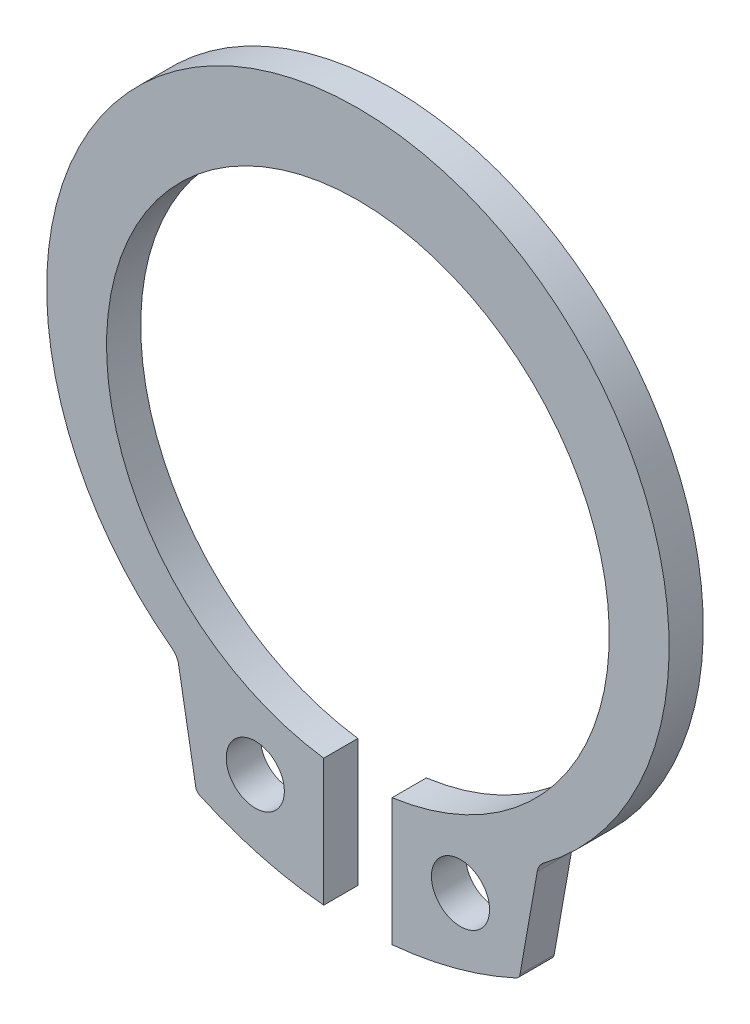
from build123d import *

# Parameters (mm, degrees)
SKETCH1_R  = 0.85
BODY_DEPTH = 1
FILLET1_R  = 0.2
FILLET2_R  = 0.5


with BuildPart() as part:
    # Sketch1 → Body (new body)
    with BuildSketch(Plane.XY):
        with BuildLine():
            Line((-1, -7.861655032), (-1, -11.584658105))
            ThreePointArc((-1, -11.584658105), (-2.905399941, -11.241198393), (-4.721604894, -10.570442794))
            Line((-4.721604894, -10.570442794), (-5.278395106, -7.412728587))
            ThreePointArc((-5.278395106, -7.412728587), (0, 9.1), (5.278395106, -7.412728587))
            Line((5.278395106, -7.412728587), (4.721604894, -10.570442794))
            ThreePointArc((4.721604894, -10.570442794), (2.905399941, -11.241198393), (1, -11.584658105))
            Line((1, -11.584658105), (1, -7.861655032))
            ThreePointArc((1, -7.861655032), (0, 6.77), (-1, -7.861655032))
        make_face()
        with Locations(Location((3, -9.277125962, 0), (0, 0, 180))):
            Circle(SKETCH1_R, mode=Mode.SUBTRACT)
        with Locations((-3, -9.277125962)):
            Circle(SKETCH1_R, mode=Mode.SUBTRACT)
    extrude(amount=-BODY_DEPTH)

    # Fillet1
    fillet1_edges = [part.edges().sort_by_distance(p)[0] for p in [
        (-4.721604894, -10.570442794, -0.5),
        (4.721604894, -10.570442794, -0.5),
    ]]
    fillet(fillet1_edges, radius=FILLET1_R)

    # Fillet2
    fillet2_edges = [part.edges().sort_by_distance(p)[0] for p in [
        (-5.278395106, -7.412728587, -0.5),
        (5.278395106, -7.412728587, -0.5),
    ]]
    fillet(fillet2_edges, radius=FILLET2_R)


solid = part.part
